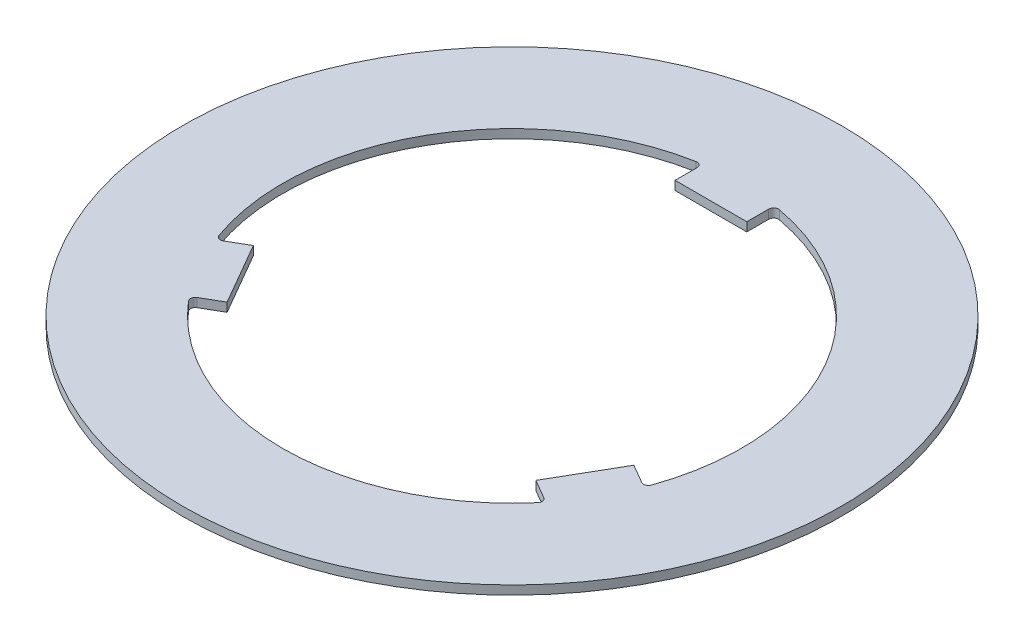
from build123d import *

# Parameters (mm, degrees)
SKETCH1_R                = 54
SKETCH1_R_2              = 37.6
BOSS_EXTRUDE1_DEPTH      = 0.725
BOSS_EXTRUDE2_DEPTH      = 0.725
FILLET1_R                = 0.8
CIRPATTERN1_COUNT        = 3
FILLET1_OF_CIRPATTERN1_R = 0.8


with BuildPart() as part:
    # Sketch1 → Boss-Extrude1 (new, symmetric)
    with BuildSketch(Plane(origin=(0, 0, 0), x_dir=(1, 0, 0), z_dir=(0, 1, 0))):
        with Locations(Location((0, 0, 0), (0, 0, 270))):
            Circle(SKETCH1_R)
        with Locations(Location((0, 0, 0), (0, 0, 270))):
            Circle(SKETCH1_R_2, mode=Mode.SUBTRACT)
    extrude(amount=BOSS_EXTRUDE1_DEPTH, both=True)

    # Sketch2 → Boss-Extrude2 (add, symmetric)
    with BuildSketch(Plane(origin=(0, 0, 0), x_dir=(1, 0, 0), z_dir=(0, 1, 0))):
        with BuildLine():
            Line((-5.875, 32.6), (5.875, 32.6))
            Line((5.875, 32.6), (5.875, 37.138179479))
            ThreePointArc((5.875, 37.138179479), (0, 37.6), (-5.875, 37.138179479))
            Line((-5.875, 37.138179479), (-5.875, 32.6))
        make_face()
    boss_extrude2 = extrude(amount=BOSS_EXTRUDE2_DEPTH, both=True)

    # Fillet1
    fillet1_edges = [part.edges().sort_by_distance(p)[0] for p in [
        (-5.875, 0, -37.138179479),
        (5.875, 0, -37.138179479),
    ]]
    fillet(fillet1_edges, radius=FILLET1_R)

    # CirPattern1: Boss-Extrude2 ×3 about axis
    cirpattern1_axis = Axis((0, 0, 0), (0, 1, 0))
    for i in range(1, CIRPATTERN1_COUNT):
        add(boss_extrude2.rotate(cirpattern1_axis, i * 360 / CIRPATTERN1_COUNT))

    # Fillet1 of CirPattern1
    fillet1_of_cirpattern1_edges = [part.edges().sort_by_distance(p)[0] for p in [
        (-29.225106879, 0, 23.656988987),
        (-35.100106879, 0, 13.481190492),
        (35.100106879, 0, 13.481190492),
        (29.225106879, 0, 23.656988987),
    ]]
    fillet(fillet1_of_cirpattern1_edges, radius=FILLET1_OF_CIRPATTERN1_R)


solid = part.part
